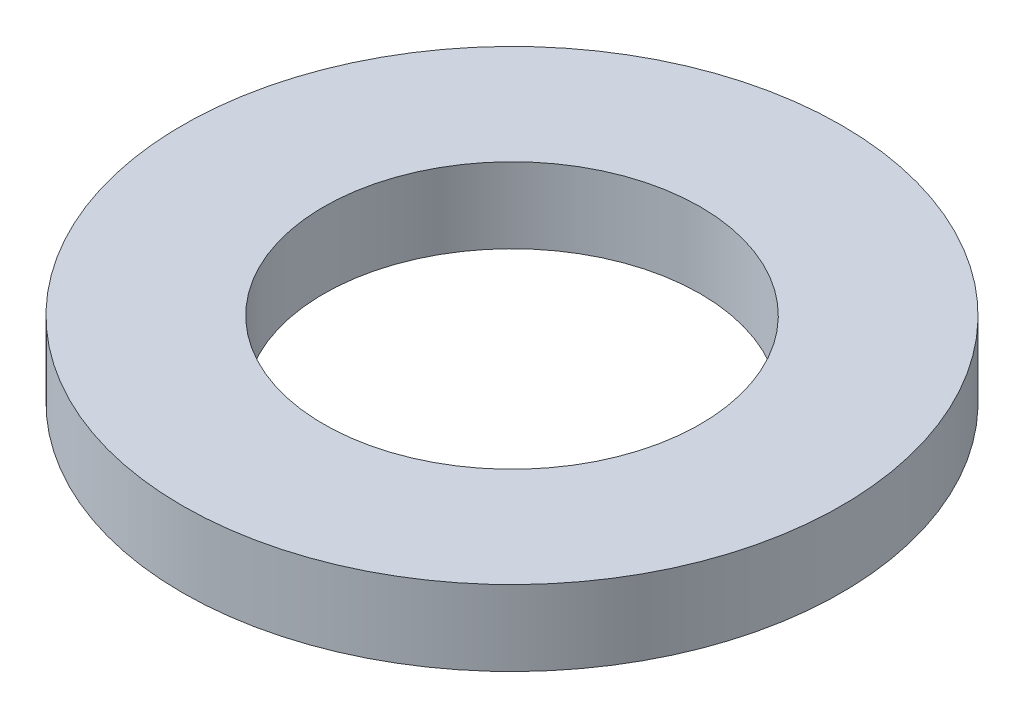
from build123d import *

# Parameters (mm, degrees)
SKETCH1_W = 3
SKETCH1_H = 1.6


with BuildPart() as part:
    # Sketch1 → Revolve1 (revolve)
    with BuildSketch(Plane.XY, mode=Mode.PRIVATE) as revolve1_sk:
        with Locations((5.5, 0.8)):
            Rectangle(SKETCH1_W, SKETCH1_H)
    revolve(revolve1_sk.sketch.rotate(Axis((0, 1.6, 0), (0, -1, 0)), 270), axis=Axis((0, 1.6, 0), (0, -1, 0)))


solid = part.part
